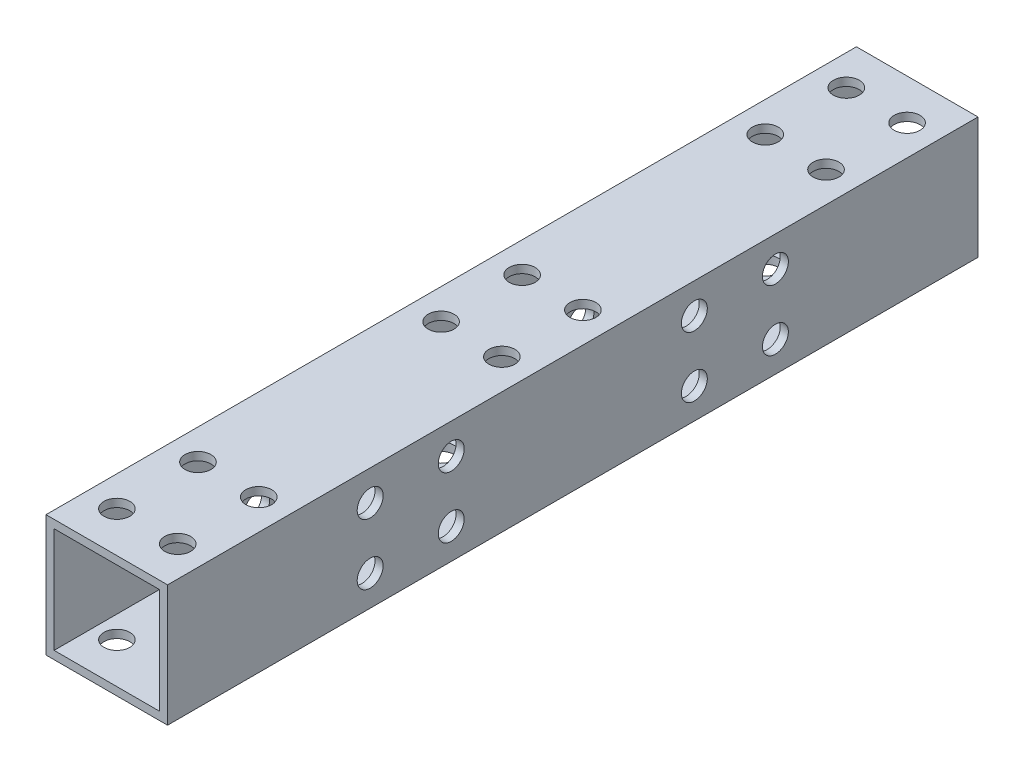
from build123d import *

# Parameters (mm, degrees)
SKETCH_1_W          = 15
SKETCH_1_H          = 15
SKETCH_1_W_2        = 13
SKETCH_1_H_2        = 13
EXTRUDE_1_DEPTH     = 100
SKETCH_2_R          = 1.6
CUT_EXTRUDE_1_DEPTH = 103.225241501
SKETCH_3_R          = 1.6
CUT_EXTRUDE_2_DEPTH = 103.225241501


with BuildPart() as part:
    # 草图1 → 拉伸-薄壁1 (new body)
    with BuildSketch(Plane.XY):
        with Locations((7.5, -7.5)):
            Rectangle(SKETCH_1_W, SKETCH_1_H)
        with Locations((7.5, -7.5)):
            Rectangle(SKETCH_1_W_2, SKETCH_1_H_2, mode=Mode.SUBTRACT)
    extrude(amount=EXTRUDE_1_DEPTH)

    # 草图2 → 切除-拉伸1 (cut, through all)
    with BuildSketch(Plane(origin=(15, 0, 0), x_dir=(0, 0, -1), z_dir=(1, 0, 0))):
        with Locations((-75, -3.75)):
            Circle(SKETCH_2_R)
        with Locations((-75, -11.25)):
            Circle(SKETCH_2_R)
        with Locations((-65, -11.25)):
            Circle(SKETCH_2_R)
        with Locations((-65, -3.75)):
            Circle(SKETCH_2_R)
        with Locations((-25, -3.75)):
            Circle(SKETCH_2_R)
        with Locations((-25, -11.25)):
            Circle(SKETCH_2_R)
        with Locations((-35, -11.25)):
            Circle(SKETCH_2_R)
        with Locations((-35, -3.75)):
            Circle(SKETCH_2_R)
    extrude(amount=-CUT_EXTRUDE_1_DEPTH, mode=Mode.SUBTRACT)

    # 草图3 → 切除-拉伸2 (cut, through all)
    with BuildSketch(Plane(origin=(0, 0, 0), x_dir=(1, 0, 0), z_dir=(0, 1, 0))):
        with Locations(Location((3.75, -5, 0), (0, 0, 270))):
            Circle(SKETCH_3_R)
        with Locations(Location((11.25, -5, 0), (0, 0, 90))):
            Circle(SKETCH_3_R)
        with Locations(Location((11.25, -15, 0), (0, 0, 270))):
            Circle(SKETCH_3_R)
        with Locations(Location((3.75, -15, 0), (0, 0, 90))):
            Circle(SKETCH_3_R)
        with Locations(Location((3.75, -45, 0), (0, 0, 270))):
            Circle(SKETCH_3_R)
        with Locations(Location((11.25, -45, 0), (0, 0, 90))):
            Circle(SKETCH_3_R)
        with Locations(Location((11.25, -55, 0), (0, 0, 270))):
            Circle(SKETCH_3_R)
        with Locations(Location((3.75, -55, 0), (0, 0, 90))):
            Circle(SKETCH_3_R)
        with Locations(Location((3.75, -85, 0), (0, 0, 270))):
            Circle(SKETCH_3_R)
        with Locations(Location((11.25, -85, 0), (0, 0, 90))):
            Circle(SKETCH_3_R)
        with Locations(Location((11.25, -95, 0), (0, 0, 270))):
            Circle(SKETCH_3_R)
        with Locations(Location((3.75, -95, 0), (0, 0, 90))):
            Circle(SKETCH_3_R)
    extrude(amount=-CUT_EXTRUDE_2_DEPTH, mode=Mode.SUBTRACT)


solid = part.part
